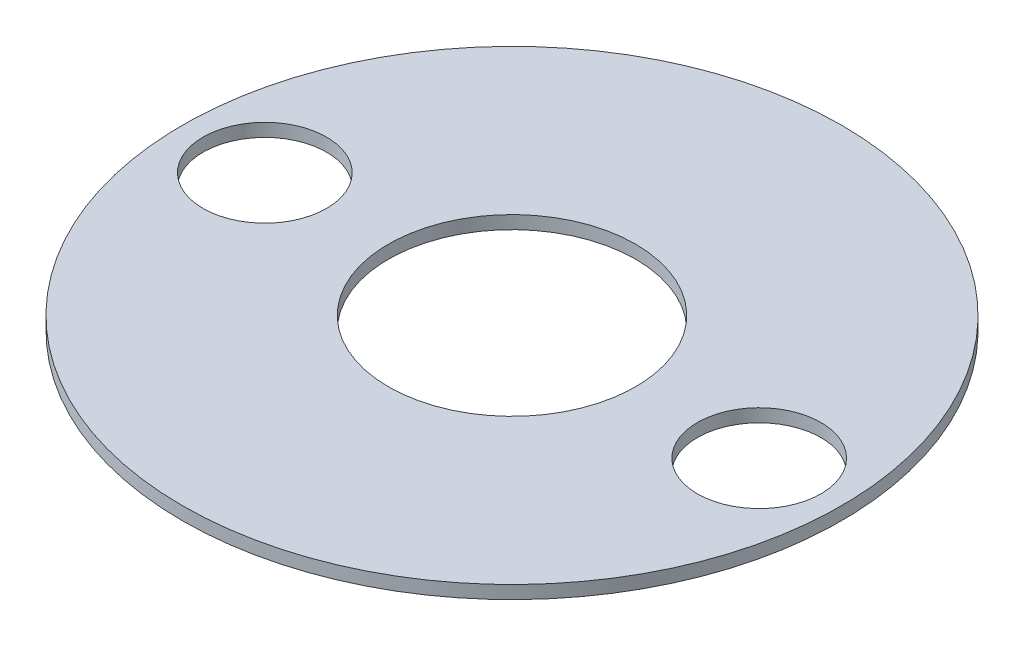
from build123d import *

# Parameters (mm, degrees)
SKETCH1_R           = 7
BOSS_EXTRUDE1_DEPTH = 0.3175
SKETCH2_R           = 8
BOSS_EXTRUDE3_DEPTH = 0.3175
SKETCH3_R           = 1.5
CUT_EXTRUDE2_DEPTH  = 0.3175
SKETCH4_R           = 1.5
CUT_EXTRUDE3_DEPTH  = 0.3175
SKETCH5_R           = 3
CUT_EXTRUDE4_DEPTH  = 0.3175


with BuildPart() as part:
    # Sketch1 → Boss-Extrude1 (new body)
    with BuildSketch(Plane(origin=(0, 0, 0), x_dir=(1, 0, 0), z_dir=(0, 1, 0))):
        with Locations(Location((0, 0, 0), (0, 0, 270))):
            Circle(SKETCH1_R)
    extrude(amount=BOSS_EXTRUDE1_DEPTH)

    # Sketch2 → Boss-Extrude3 (add)
    with BuildSketch(Plane(origin=(0, 0.3175, 0), x_dir=(1, 0, 0), z_dir=(0, 1, 0))):
        with Locations(Location((0, 0, 0), (0, 0, 270))):
            Circle(SKETCH2_R)
    extrude(amount=-BOSS_EXTRUDE3_DEPTH)

    # Sketch3 → Cut-Extrude2 (cut)
    with BuildSketch(Plane(origin=(0, 0.3175, 0), x_dir=(1, 0, 0), z_dir=(0, 1, 0))):
        with Locations(Location((6, 0, 0), (0, 0, 270))):
            Circle(SKETCH3_R)
    extrude(amount=-CUT_EXTRUDE2_DEPTH, mode=Mode.SUBTRACT)

    # Sketch4 → Cut-Extrude3 (cut)
    with BuildSketch(Plane(origin=(0, 0.3175, 0), x_dir=(1, 0, 0), z_dir=(0, 1, 0))):
        with Locations(Location((-6, 0, 0), (0, 0, 270))):
            Circle(SKETCH4_R)
    extrude(amount=-CUT_EXTRUDE3_DEPTH, mode=Mode.SUBTRACT)

    # Sketch5 → Cut-Extrude4 (cut)
    with BuildSketch(Plane(origin=(0, 0.3175, 0), x_dir=(1, 0, 0), z_dir=(0, 1, 0))):
        with Locations(Location((0, 0, 0), (0, 0, 270))):
            Circle(SKETCH5_R)
    extrude(amount=-CUT_EXTRUDE4_DEPTH, mode=Mode.SUBTRACT)


solid = part.part
